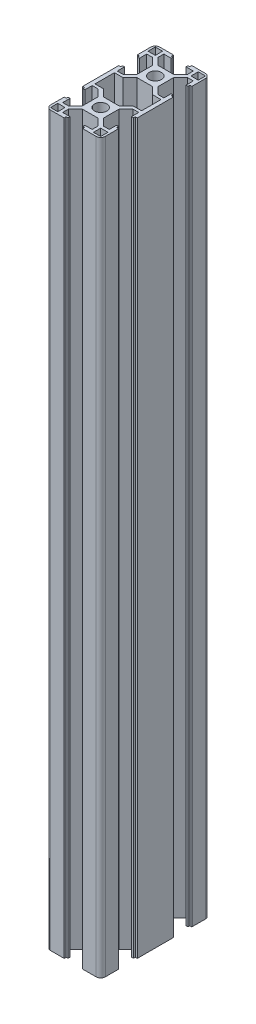
from build123d import *

# Parameters (mm, degrees)
SKETCH1_R            = 3.4
SKETCH1_W            = 4
SKETCH1_H            = 4
BOSS_EXTRUDE1_DEPTH  = 400
FILLET1_R            = 2.5
FILLET1_OF_MIRROR1_R = 2.5


with BuildPart() as part:
    # Sketch1 → Boss-Extrude1 (new body)
    with BuildSketch(Plane(origin=(0, 0, 0), x_dir=(1, 0, 0), z_dir=(0, 1, 0))):
        Polygon((-4.244365081, 20.8), (4.244365081, 20.8), (8.1, 24.655634919), (8.1, 27.8), (4.1, 27.8), (4.1, 28.9), (5.1, 28.9), (5.1, 30), (13.444365081, 30), (15, 30), (15, 28.444365081), (15, 20.1), (13.9, 20.1), (13.9, 19.1), (12.8, 19.1), (12.8, 23.1), (9.655634919, 23.1), (5.8, 19.244365081), (5.8, 10.755634919), (9.655634919, 6.9), (12.8, 6.9), (12.8, 10.9), (13.9, 10.9), (13.9, 9.9), (15, 9.9), (15, 1.555634919), (15, 0), (13.444365081, 0), (12.8, 0), (12.8, 5.344365081), (8.1, 5.344365081), (4.244365081, 9.2), (-4.244365081, 9.2), (-8.1, 5.344365081), (-12.8, 5.344365081), (-12.8, 0), (-13.444365081, 0), (-15, 0), (-15, 1.555634919), (-15, 9.9), (-13.9, 9.9), (-13.9, 10.9), (-12.8, 10.9), (-12.8, 6.9), (-9.655634919, 6.9), (-5.8, 10.755634919), (-5.8, 19.244365081), (-9.655634919, 23.1), (-12.8, 23.1), (-12.8, 19.1), (-13.9, 19.1), (-13.9, 20.1), (-15, 20.1), (-15, 28.444365081), (-15, 30), (-13.444365081, 30), (-5.1, 30), (-5.1, 28.9), (-4.1, 28.9), (-4.1, 27.8), (-8.1, 27.8), (-8.1, 24.655634919), align=None)
        with Locations(Location((0, 15, 0), (0, 0, 270))):
            Circle(SKETCH1_R, mode=Mode.SUBTRACT)
        with Locations((11.8, 26.8)):
            Rectangle(SKETCH1_W, SKETCH1_H, mode=Mode.SUBTRACT)
        with Locations((-11.8, 26.8)):
            Rectangle(SKETCH1_W, SKETCH1_H, mode=Mode.SUBTRACT)
    boss_extrude1 = extrude(amount=BOSS_EXTRUDE1_DEPTH)

    # Fillet1
    fillet1_edges = [part.edges().sort_by_distance(p)[0] for p in [
        (15, 200, -30),
        (-15, 200, -30),
    ]]
    fillet(fillet1_edges, radius=FILLET1_R)

    # Mirror1: Boss-Extrude1 across plane
    add(boss_extrude1.mirror(Plane.XY))

    # Fillet1 of Mirror1
    fillet1_of_mirror1_edges = [part.edges().sort_by_distance(p)[0] for p in [
        (15, 200, 30),
        (-15, 200, 30),
    ]]
    fillet(fillet1_of_mirror1_edges, radius=FILLET1_OF_MIRROR1_R)


solid = part.part
